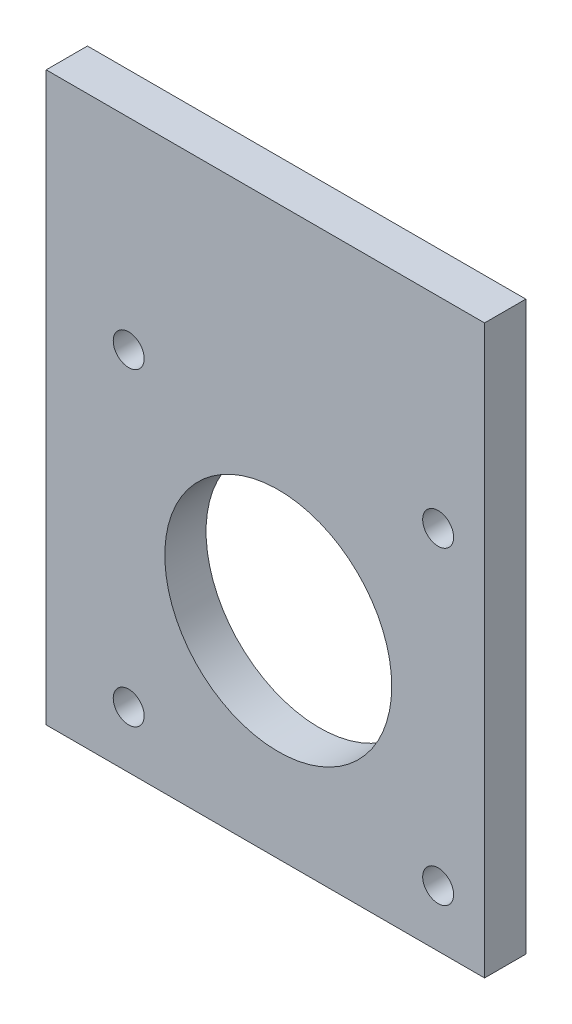
from build123d import *

# Parameters (mm, degrees)
SKETCH1_W           = 42.5
SKETCH1_H           = 40
BOSS_EXTRUDE1_DEPTH = 2
SKETCH2_R           = 1.5
CUT_EXTRUDE1_DEPTH  = 4
SKETCH3_R           = 11
CUT_EXTRUDE2_DEPTH  = 4
SKETCH4_W           = 42.5
SKETCH4_H           = 4
BOSS_EXTRUDE2_DEPTH = 15


with BuildPart() as part:
    # Sketch1 → Boss-Extrude1 (new, symmetric)
    with BuildSketch(Plane.XY):
        Rectangle(SKETCH1_W, SKETCH1_H)
    extrude(amount=BOSS_EXTRUDE1_DEPTH, both=True)

    # Sketch2 → Cut-Extrude1 (cut)
    with BuildSketch(Plane(origin=(0, 0, -2), x_dir=(-1, 0, 0), z_dir=(0, 0, -1))):
        with Locations((-16.75, 15.5)):
            Circle(SKETCH2_R)
        with Locations((13.25, 15.5)):
            Circle(SKETCH2_R)
        with Locations((13.25, -14.5)):
            Circle(SKETCH2_R)
        with Locations((-16.75, -14.5)):
            Circle(SKETCH2_R)
    extrude(amount=-CUT_EXTRUDE1_DEPTH, mode=Mode.SUBTRACT)

    # Sketch3 → Cut-Extrude2 (cut)
    with BuildSketch(Plane.XY.offset(2)):
        with Locations((1.25, 0)):
            Circle(SKETCH3_R)
    extrude(amount=-CUT_EXTRUDE2_DEPTH, mode=Mode.SUBTRACT)

    # Sketch4 → Boss-Extrude2 (add)
    with BuildSketch(Plane(origin=(0, 20, 0), x_dir=(1, 0, 0), z_dir=(0, 1, 0))):
        Rectangle(SKETCH4_W, SKETCH4_H)
    extrude(amount=BOSS_EXTRUDE2_DEPTH)


solid = part.part
